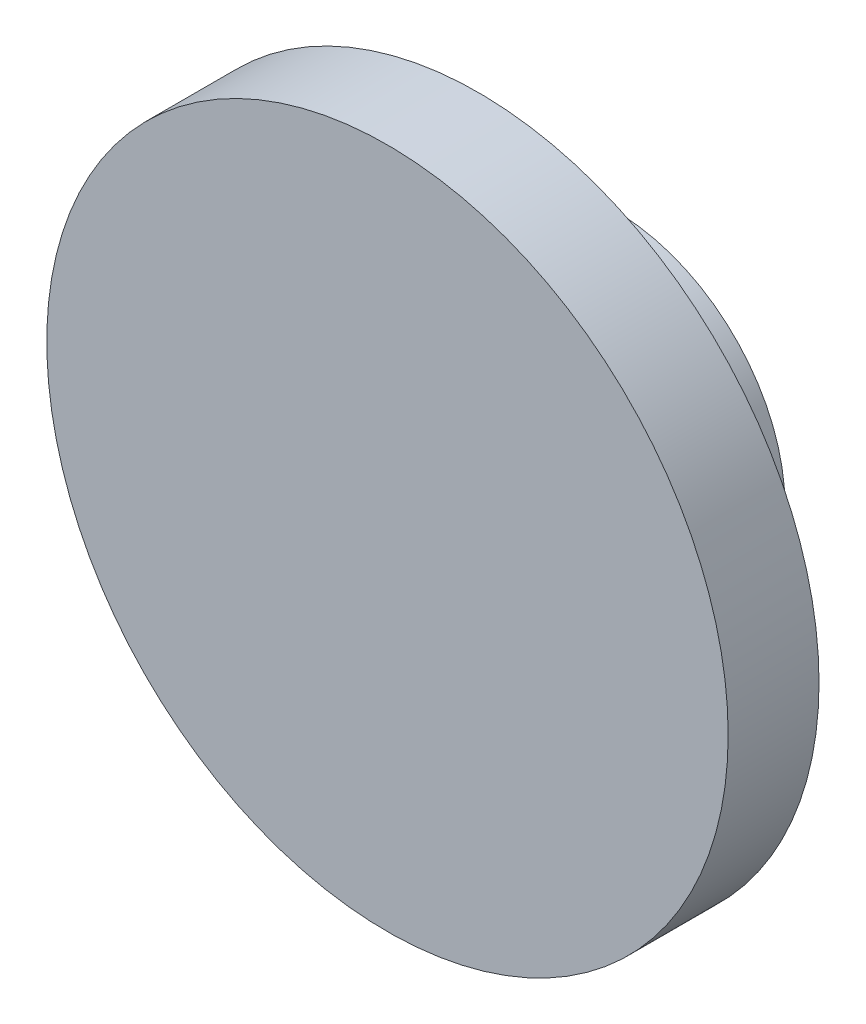
from build123d import *

# Parameters (mm, degrees)
SKETCH1_R           = 15
BOSS_EXTRUDE2_DEPTH = 4
SKETCH2_R           = 7.5
BOSS_EXTRUDE3_DEPTH = 6
SKETCH3_R           = 4
CUT_EXTRUDE1_DEPTH  = 2


with BuildPart() as part:
    # Sketch1 → Boss-Extrude2 (new body)
    with BuildSketch(Plane.XY):
        Circle(SKETCH1_R)
    extrude(amount=BOSS_EXTRUDE2_DEPTH)

    # Sketch2 → Boss-Extrude3 (add)
    with BuildSketch(Plane(origin=(0, 0, 0), x_dir=(-1, 0, 0), z_dir=(0, 0, -1))):
        Circle(SKETCH2_R)
    extrude(amount=BOSS_EXTRUDE3_DEPTH)

    # Sketch3 → Cut-Extrude1 (cut)
    with BuildSketch(Plane(origin=(0, 0, -6), x_dir=(-1, 0, 0), z_dir=(0, 0, -1))):
        Circle(SKETCH3_R)
    extrude(amount=-CUT_EXTRUDE1_DEPTH, mode=Mode.SUBTRACT)

    # Sketch5 → Cut-Revolve2 (revolve, cut)
    with BuildSketch(Plane(origin=(0, 0, 0), x_dir=(0, 0, -1), z_dir=(1, 0, 0))):
        with BuildLine():
            Line((4, 6.5), (4, -6.5))
            ThreePointArc((4, -6.5), (-2.5, 0), (4, 6.5))
        make_face()
    revolve(axis=Axis((0, 6.5, -4), (0, -1, 0)), mode=Mode.SUBTRACT)


solid = part.part
